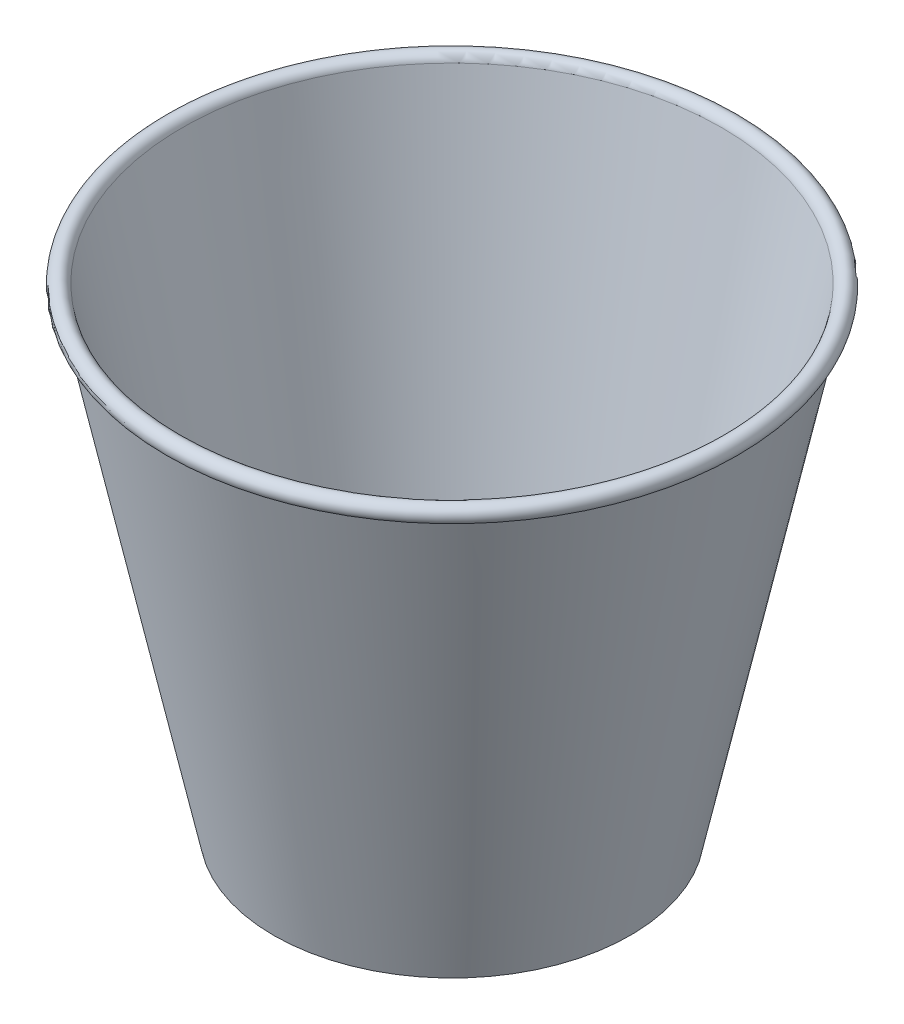
from build123d import *


with BuildPart() as part:
    # Sketch1 → Revolve1 (revolve)
    with BuildSketch(Plane(origin=(0, 0, 0), x_dir=(0, 0, -1), z_dir=(1, 0, 0))):
        with BuildLine():
            Line((-34, 0), (-21.600076356, -58.459423591))
            ThreePointArc((-21.600076356, -58.459423591), (-10.802480834, -58.114868885), (0, -58))
            Line((0, -58), (0, -59.5))
            ThreePointArc((0, -59.5), (-11.252777435, -59.625015428), (-22.5, -60))
            Line((-22.5, -60), (-34.934557026, -1.377297375))
            Line((-34.934557026, -1.377297375), (-36, -0.825182107))
            ThreePointArc((-36, -0.825182107), (-35.495602769, 0.788605057), (-34, 0))
        make_face()
    revolve(axis=Axis((0, 0, 0), (0, -1, 0)))


solid = part.part
